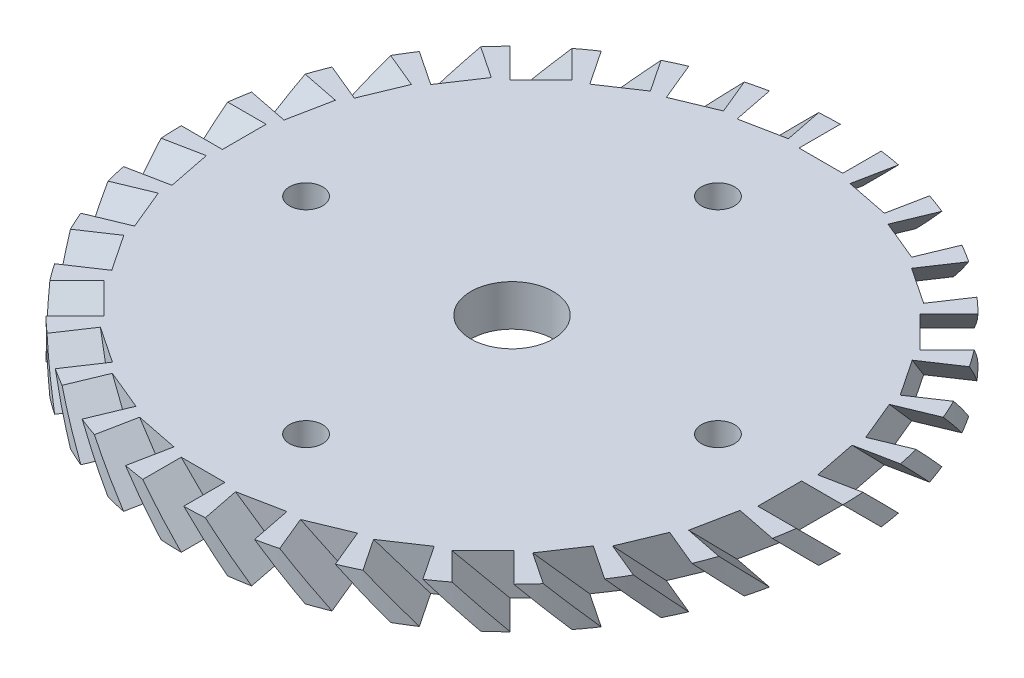
from build123d import *

# Parameters (mm, degrees)
SKETCH1_R                                          = 50.8
SKETCH1_R_2                                        = 6.35
BOSS_EXTRUDE1_DEPTH                                = 6.35
CUT_EXTRUDE1_DEPTH                                 = 6.35
CIRPATTERN1_COUNT                                  = 32
CSK_FOR_10_FLAT_HEAD_MACHINE_SCREW_100_D           = 5.1054
CSK_FOR_10_FLAT_HEAD_MACHINE_SCREW_100_CSINK_D     = 9.779
CSK_FOR_10_FLAT_HEAD_MACHINE_SCREW_100_CSINK_ANGLE = 100
CIRPATTERN2_COUNT                                  = 4


with BuildPart() as part:
    # Sketch1 → Boss-Extrude1 (new body)
    with BuildSketch(Plane(origin=(0, 0, 0), x_dir=(1, 0, 0), z_dir=(0, 1, 0))):
        with Locations(Location((0, 0, 0), (0, 0, 270))):
            Circle(SKETCH1_R)
        with Locations(Location((0, 0, 0), (0, 0, 270))):
            Circle(SKETCH1_R_2, mode=Mode.SUBTRACT)
    extrude(amount=BOSS_EXTRUDE1_DEPTH)

    # Sketch2 → Cut-Extrude1 (cut)
    with BuildSketch(Plane.XY.offset(50.8)):
        Polygon((-11.786586159, 18.329182204), (15.154182204, -8.611586159), (11.786586159, -11.979182204), (-15.154182204, 14.961586159), align=None)
    cut_extrude1 = extrude(amount=-CUT_EXTRUDE1_DEPTH, mode=Mode.SUBTRACT)

    # CirPattern1: Cut-Extrude1 ×32 about axis
    cirpattern1_axis = Axis((0, 0, 0), (0, 1, 0))
    for i in range(1, CIRPATTERN1_COUNT):
        add(cut_extrude1.rotate(cirpattern1_axis, i * 360 / CIRPATTERN1_COUNT), mode=Mode.SUBTRACT)

    # CSK for #10 Flat Head Machine Screw (100)1 (through all)
    with Locations(Plane(origin=(0, 0, 31.75), x_dir=(0, 0, -1), z_dir=(0, -1, 0))):
        with Locations((0, 0)):
            csk_for_10_flat_head_machine_screw_100 = CounterSinkHole(CSK_FOR_10_FLAT_HEAD_MACHINE_SCREW_100_D / 2, CSK_FOR_10_FLAT_HEAD_MACHINE_SCREW_100_CSINK_D / 2, counter_sink_angle=CSK_FOR_10_FLAT_HEAD_MACHINE_SCREW_100_CSINK_ANGLE)

    # CirPattern2: CSK for #10 Flat Head Machine Screw (100)1 ×4 about axis
    cirpattern2_axis = Axis((0, 0, 0), (0, 1, 0))
    for i in range(1, CIRPATTERN2_COUNT):
        add(csk_for_10_flat_head_machine_screw_100.rotate(cirpattern2_axis, i * 360 / CIRPATTERN2_COUNT), mode=Mode.SUBTRACT)


solid = part.part
